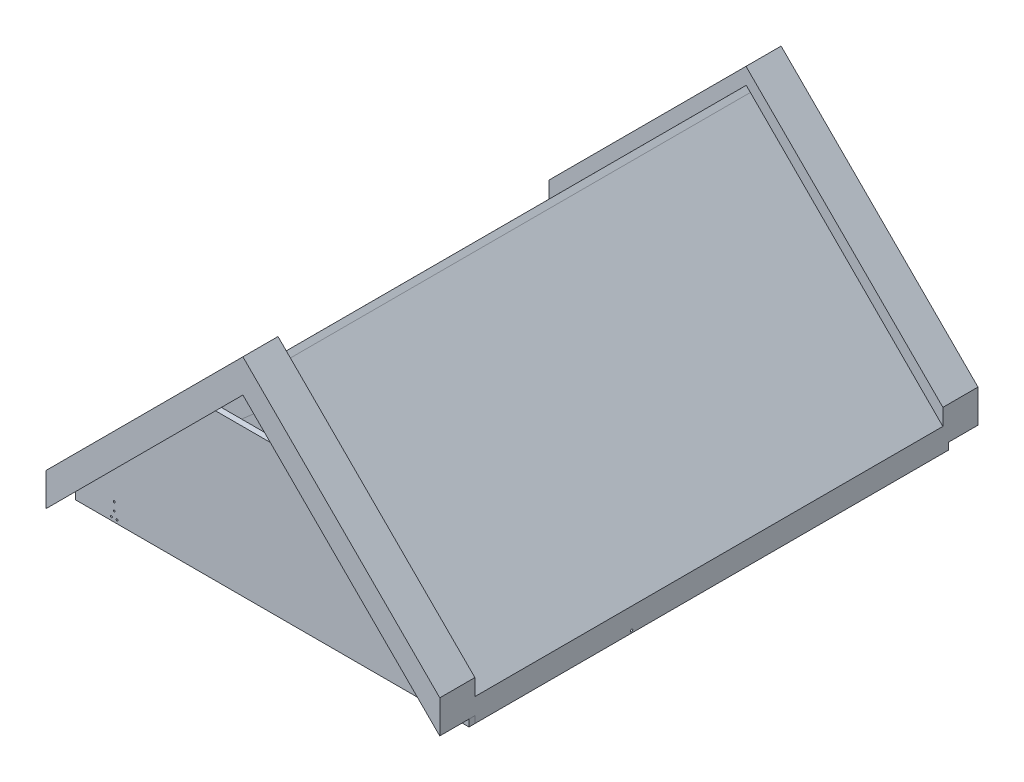
from build123d import *

# Parameters (mm, degrees)
BOSS_EXTRUDE1_DEPTH      = 2000
SHELL1_T                 = -10
SKETCH3_W                = 150
SKETCH3_H                = 1096.015510839
BOSS_EXTRUDE2_DEPTH      = 100
SKETCH7_W                = 150
SKETCH7_H                = 1089.949493661
BOSS_EXTRUDE4_DEPTH      = 100
CUT_EXTRUDE1_DEPTH       = 6
CUT_EXTRUDE1_DEPTH_BACK  = 6.066017
SKETCH8_W                = 150
SKETCH8_H                = 100
SKETCH9_W                = 150
SKETCH9_H                = 100
BOSS_EXTRUDE5_DEPTH      = 239.05
SKETCH10_W               = 150
SKETCH10_H               = 100
BOSS_EXTRUDE6_DEPTH      = 399.5
CUT_EXTRUDE4_DEPTH       = 1197.5
SKETCH14_W               = 2000
SKETCH14_H               = 100
BOSS_EXTRUDE7_DEPTH      = 25
SKETCH15_W               = 2000
SKETCH15_H               = 100
BOSS_EXTRUDE8_DEPTH      = 25
SKETCH16_W               = 2000
SKETCH16_H               = 25
BOSS_EXTRUDE9_DEPTH      = 1436
SKETCH17_W               = 25
SKETCH17_H               = 2000
BOSS_EXTRUDE10_DEPTH     = 1436
CUT_EXTRUDE11_DEPTH      = 1286
CUT_EXTRUDE12_DEPTH      = 1286
BOSS_EXTRUDE13_DEPTH     = 50
BOSS_EXTRUDE14_DEPTH     = 50
BOSS_EXTRUDE15_DEPTH     = 50
BOSS_EXTRUDE16_DEPTH     = 50
BOSS_EXTRUDE17_DEPTH     = 50
BOSS_EXTRUDE18_DEPTH     = 50
BOSS_EXTRUDE19_DEPTH     = 50
BOSS_EXTRUDE20_DEPTH     = 50
SKETCH34_W               = 1400
SKETCH34_H               = 2000
BOSS_EXTRUDE21_DEPTH     = 25
BOSS_EXTRUDE22_DEPTH     = 25
BOSS_EXTRUDE23_DEPTH     = 25
CUT_EXTRUDE16_DEPTH      = 2777.052898712
CUT_EXTRUDE16_DEPTH_BACK = 2777.052898712
SKETCH43_R               = 5
SKETCH45_R               = 4
CUT_EXTRUDE17_DEPTH      = 30


with BuildPart() as part:
    # Sketch1 → Boss-Extrude1 (new body)
    with BuildSketch(Plane.XY):
        Polygon((0, 0), (1400, 0), (700, 700), align=None)
    extrude(amount=BOSS_EXTRUDE1_DEPTH)

    # Shell1
    shell1_openings = [part.faces().sort_by_distance(p)[0] for p in [
        (700, 0, 1000),
    ]]
    offset(amount=SHELL1_T, openings=shell1_openings, kind=Kind.INTERSECTION)


with BuildPart() as body_2:
    # Sketch3 → Boss-Extrude2 (new body)
    with BuildSketch(Plane(origin=(0, 0, 0), x_dir=(0, 0, 1), z_dir=(-0.7071067811865477, 0.7071067811865475, 0))):
        with Locations((2075, 548.00775542)):
            Rectangle(SKETCH3_W, SKETCH3_H)
    extrude(amount=BOSS_EXTRUDE2_DEPTH)

    # Sketch7 → Boss-Extrude4 (add)
    with BuildSketch(Plane(origin=(700, 700, 0), x_dir=(0, 0, -1), z_dir=(0.7071067811865477, 0.7071067811865475, 0))):
        with Locations((-2075, -444.974746831)):
            Rectangle(SKETCH7_W, SKETCH7_H)
    extrude(amount=BOSS_EXTRUDE4_DEPTH)

    # Sketch8 → Cut-Extrude1 (cut, two sides: drawn at the far end of the back side and taken through both)
    with BuildSketch(Plane(origin=(775, 775, 0), x_dir=(0, 0, -1), z_dir=(0.7071067811865476, 0.7071067811865476, 0)).offset(-CUT_EXTRUDE1_DEPTH_BACK)):
        with Locations((-2075, 50)):
            Rectangle(SKETCH8_W, SKETCH8_H)
    extrude(amount=CUT_EXTRUDE1_DEPTH + CUT_EXTRUDE1_DEPTH_BACK, mode=Mode.SUBTRACT)

    # Sketch9 → Boss-Extrude5 (add)
    with BuildSketch(Plane(origin=(0, 0, 0), x_dir=(0, 0, 1), z_dir=(-0.7071067811865476, -0.7071067811865476, 0))):
        with Locations((2075, 50)):
            Rectangle(SKETCH9_W, SKETCH9_H)
    extrude(amount=BOSS_EXTRUDE5_DEPTH)

    # Sketch10 → Boss-Extrude6 (add)
    with BuildSketch(Plane(origin=(700, -700, 0), x_dir=(0, 0, -1), z_dir=(0.7071067811865476, -0.7071067811865476, 0))):
        with Locations((-2075, 1039.949493661)):
            Rectangle(SKETCH10_W, SKETCH10_H)
    extrude(amount=BOSS_EXTRUDE6_DEPTH)

    # Sketch13 → Cut-Extrude4 (cut)
    with BuildSketch(Plane.XY.offset(2150)):
        Polygon((-141.421356237, 0), (-141.421356237, -141.421356237), (-169.033876043, -169.033876043), (-239.744554161, -98.323197924), align=None)
        Polygon((1541.421356237, 0), (1753.199837203, -211.778480965), (1682.489159084, -282.489159084), (1541.244579542, -141.244579542), align=None)
    extrude(amount=-CUT_EXTRUDE4_DEPTH, mode=Mode.SUBTRACT)


with BuildPart() as body_3:
    # Mirror4: mirrored copy
    add(body_2.part.mirror(Plane.XY.offset(1000)))


with BuildPart() as body_2_1:
    add(body_2.part)

    add(body_3.part)  # Boss-Extrude7 merges body 3
    # Sketch14 → Boss-Extrude7 (add)
    with BuildSketch(Plane.ZY.offset(141.421356237)):
        with Locations((1000, -120.710678119)):
            Rectangle(SKETCH14_W, SKETCH14_H)
    extrude(amount=-BOSS_EXTRUDE7_DEPTH)

    # Sketch15 → Boss-Extrude8 (add)
    with BuildSketch(Plane(origin=(1541.418941738, -1.929185159, 0), x_dir=(0, 0, -1), z_dir=(0.999999216794127, -0.001251563475337267, 0))):
        with Locations((-1000, -118.693158413)):
            Rectangle(SKETCH15_W, SKETCH15_H)
    extrude(amount=-BOSS_EXTRUDE8_DEPTH)

    # Sketch16 → Boss-Extrude9 (add)
    with BuildSketch(Plane(origin=(-106.066017178, -106.066017178, 0), x_dir=(0, 0, -1), z_dir=(0.7071067811865483, 0.7071067811865468, 0))):
        with Locations((-1000, 37.5)):
            Rectangle(SKETCH16_W, SKETCH16_H)
    extrude(amount=BOSS_EXTRUDE9_DEPTH)

    # Sketch17 → Boss-Extrude10 (add)
    with BuildSketch(Plane(origin=(804.048443672, -806.063602678, 0), x_dir=(0.7079912163968599, 0.7062212383558673, 0), z_dir=(-0.7062212383558673, 0.7079912163968599, 0))):
        with Locations((1028.875241871, -1000)):
            Rectangle(SKETCH17_W, SKETCH17_H)
    extrude(amount=BOSS_EXTRUDE10_DEPTH)

    # Sketch27 → Cut-Extrude11 (cut)
    with BuildSketch(Plane(origin=(719.584743808, 717.785781949, 0), x_dir=(0, 0, 1), z_dir=(-0.7079912163968599, -0.7062212383558673, 0))):
        Polygon((0, 101.272137447), (0, 51.272098287), (2000, 51.272098287), (2000, 101.272137447), (2000, 297.477961859), (0, 297.477961859), align=None)
    extrude(amount=-CUT_EXTRUDE11_DEPTH, mode=Mode.SUBTRACT)

    # Sketch28 → Cut-Extrude12 (cut)
    with BuildSketch(Plane(origin=(-17.67766953, 17.67766953, 0), x_dir=(0, 0, -1), z_dir=(0.7071067811865468, -0.7071067811865483, 0))):
        Polygon((-2000, 1041.407346594), (0, 1041.407346594), (0, 1089.949493661), (0, 1286), (-2000, 1286), (-2000, 1089.949493661), align=None)
    extrude(amount=-CUT_EXTRUDE12_DEPTH, mode=Mode.SUBTRACT)

    # Sketch29 → Boss-Extrude13 (add)
    with BuildSketch(Plane(origin=(0, 0, 2000), x_dir=(-1, 0, 0), z_dir=(0, 0, -1))):
        Polygon((-701.03084385, 594.964826672), (-1466.590232409, -170.594561887), (-1516.207831122, -170.590922364), (-1516.320027106, -80.946331633), (-701.03084385, 736.386182909), (-630.320165731, 665.67550479), (116.421356237, -81.066017178), (116.421356237, -170.710678119), (64.640862765, -170.706879943), align=None)
    extrude(amount=BOSS_EXTRUDE13_DEPTH)

    # Sketch30 → Boss-Extrude14 (add)
    with BuildSketch(Plane(origin=(0, 0, 1359), x_dir=(-1, 0, 0), z_dir=(0, 0, -1))):
        Polygon((-701.03084385, 736.386182909), (-1516.320027106, -80.946331633), (-1516.207831122, -170.590922364), (-1466.590232409, -170.594561887), (-701.03084385, 594.964826672), (64.640862765, -170.706879943), (116.421356237, -170.710678119), (116.421356237, -81.066017178), align=None)
    extrude(amount=BOSS_EXTRUDE14_DEPTH)

    # Sketch31 → Boss-Extrude15 (add)
    with BuildSketch(Plane(origin=(0, 0, 691), x_dir=(-1, 0, 0), z_dir=(0, 0, -1))):
        Polygon((116.421356237, -81.066017178), (-701.03084385, 736.386182909), (-1516.320027106, -80.946331633), (-1516.207831122, -170.590922364), (-1466.590232409, -170.594561887), (-701.03084385, 594.964826672), (64.640862765, -170.706879943), (116.421356237, -170.710678119), align=None)
    extrude(amount=BOSS_EXTRUDE15_DEPTH)

    # Sketch33 → Boss-Extrude16 (add)
    with BuildSketch(Plane(origin=(0, 0, 50), x_dir=(-1, 0, 0), z_dir=(0, 0, -1))):
        Polygon((116.421356237, -170.710678119), (116.421356237, -81.066017178), (-701.03084385, 736.386182909), (-1516.320027106, -80.946331633), (-1516.207831122, -170.590922364), (-1466.590232409, -170.594561887), (-701.03084385, 594.964826672), (64.640862765, -170.706879943), align=None)
    extrude(amount=BOSS_EXTRUDE16_DEPTH)



with BuildPart() as body_3_2:
    # Sketch35 → Boss-Extrude17 (new body)
    with BuildSketch(Plane.XY.offset(2000)):
        Polygon((1341.704449553, -45.708779031), (60.357238147, -45.708779031), (-39.642761853, -145.708779031), (1441.704449553, -145.708779031), align=None)
    extrude(amount=-BOSS_EXTRUDE17_DEPTH)


with BuildPart() as body_4:
    # Sketch36 → Boss-Extrude18 (new body)
    with BuildSketch(Plane(origin=(0, 0, 1359), x_dir=(-1, 0, 0), z_dir=(0, 0, -1))):
        Polygon((39.642761853, -145.708779031), (-60.357238147, -45.708779031), (-1341.704449553, -45.708779031), (-1441.704449553, -145.708779031), align=None)
    extrude(amount=BOSS_EXTRUDE18_DEPTH)


with BuildPart() as body_5:
    # Sketch37 → Boss-Extrude19 (new body)
    with BuildSketch(Plane(origin=(0, 0, 691), x_dir=(-1, 0, 0), z_dir=(0, 0, -1))):
        Polygon((-1441.704449553, -145.708779031), (39.642761853, -145.708779031), (-60.357238147, -45.708779031), (-1341.704449553, -45.708779031), align=None)
    extrude(amount=BOSS_EXTRUDE19_DEPTH)


with BuildPart() as body_6:
    # Sketch38 → Boss-Extrude20 (new body)
    with BuildSketch(Plane(origin=(0, 0, 50), x_dir=(-1, 0, 0), z_dir=(0, 0, -1))):
        Polygon((-1341.704449553, -45.708779031), (-1441.704449553, -145.708779031), (39.642761853, -145.708779031), (-60.357238147, -45.708779031), align=None)
    extrude(amount=BOSS_EXTRUDE20_DEPTH)


with BuildPart() as body_7:
    # Sketch34 → Boss-Extrude21 (new body)
    with BuildSketch(Plane(origin=(0.012521253, -170.702137522, 0), x_dir=(0.9999999973097808, 7.335147241276342e-05, 0), z_dir=(7.335147241276342e-05, -0.9999999973097808, 0))):
        with Locations((701.018757721, 1000)):
            Rectangle(SKETCH34_W, SKETCH34_H)
    extrude(amount=-BOSS_EXTRUDE21_DEPTH)


with BuildPart() as body_8:
    # Sketch39 → Boss-Extrude22 (new body)
    with BuildSketch(Plane.XY.offset(2000)):
        Polygon((-64.640862765, -170.706879943), (1466.590232409, -170.594561887), (1516.207831122, -170.590922364), (1541.207811542, -170.62221145), (1541.244579542, -141.244579542), (941.956165613, 458.043834387), (458.043834387, 458.043834387), (-141.421356237, -141.421356237), (-141.421356237, -170.710678119), (-116.421356237, -170.710678119), align=None)
    extrude(amount=BOSS_EXTRUDE22_DEPTH)

    # Sketch45 → Cut-Extrude17 (cut)
    with BuildSketch(Plane.XY.offset(2000)):
        with Locations((13.031645739, -156.202062795)):
            Circle(SKETCH45_R)
        with Locations((37.031645739, -156.202062795)):
            Circle(SKETCH45_R)
        with Locations((25.031645739, -129.202062795)):
            Circle(SKETCH45_R)
        with Locations((25.031645739, -95.202062795)):
            Circle(SKETCH45_R)
        with Locations((1365.031641973, -156.099664126)):
            Circle(SKETCH45_R)
        with Locations((1389.031641973, -156.099664126)):
            Circle(SKETCH45_R)
        with Locations((1377.031641973, -129.099664126)):
            Circle(SKETCH45_R)
        with Locations((1377.031641973, -95.099664126)):
            Circle(SKETCH45_R)
    extrude(amount=CUT_EXTRUDE17_DEPTH, mode=Mode.SUBTRACT)


with BuildPart() as body_2_2:
    add(body_2_1.part)

    add(body_6.part)  # Boss-Extrude23 merges body 6

    add(body_7.part)  # Boss-Extrude23 merges body 7
    # Sketch40 → Boss-Extrude23 (add)
    with BuildSketch(Plane(origin=(0, 0, 0), x_dir=(-1, 0, 0), z_dir=(0, 0, -1))):
        Polygon((-1466.590232409, -170.594561887), (64.640862765, -170.706879943), (116.421356237, -170.710678119), (141.421356237, -170.710678119), (141.421356237, -141.421356237), (-458.043834387, 458.043834387), (-941.956165613, 458.043834387), (-1541.244579542, -141.244579542), (-1541.207811542, -170.62221145), (-1516.207831122, -170.590922364), align=None)
    extrude(amount=BOSS_EXTRUDE23_DEPTH)

    # Sketch43 → Cut-Extrude16 (cut, two sides: drawn at the far end of the back side and taken through both)
    with BuildSketch(Plane(origin=(0, 0, 0), x_dir=(0, 0, -1), z_dir=(1, 0, 0)).offset(-CUT_EXTRUDE16_DEPTH_BACK)):
        with Locations(Location((-1330, -160.62221145, 0), (0, 0, 270))):
            Circle(SKETCH43_R)
    extrude(amount=CUT_EXTRUDE16_DEPTH + CUT_EXTRUDE16_DEPTH_BACK, mode=Mode.SUBTRACT)


solid = Compound([part.part, body_3_2.part, body_4.part, body_5.part, body_8.part, body_2_2.part])
